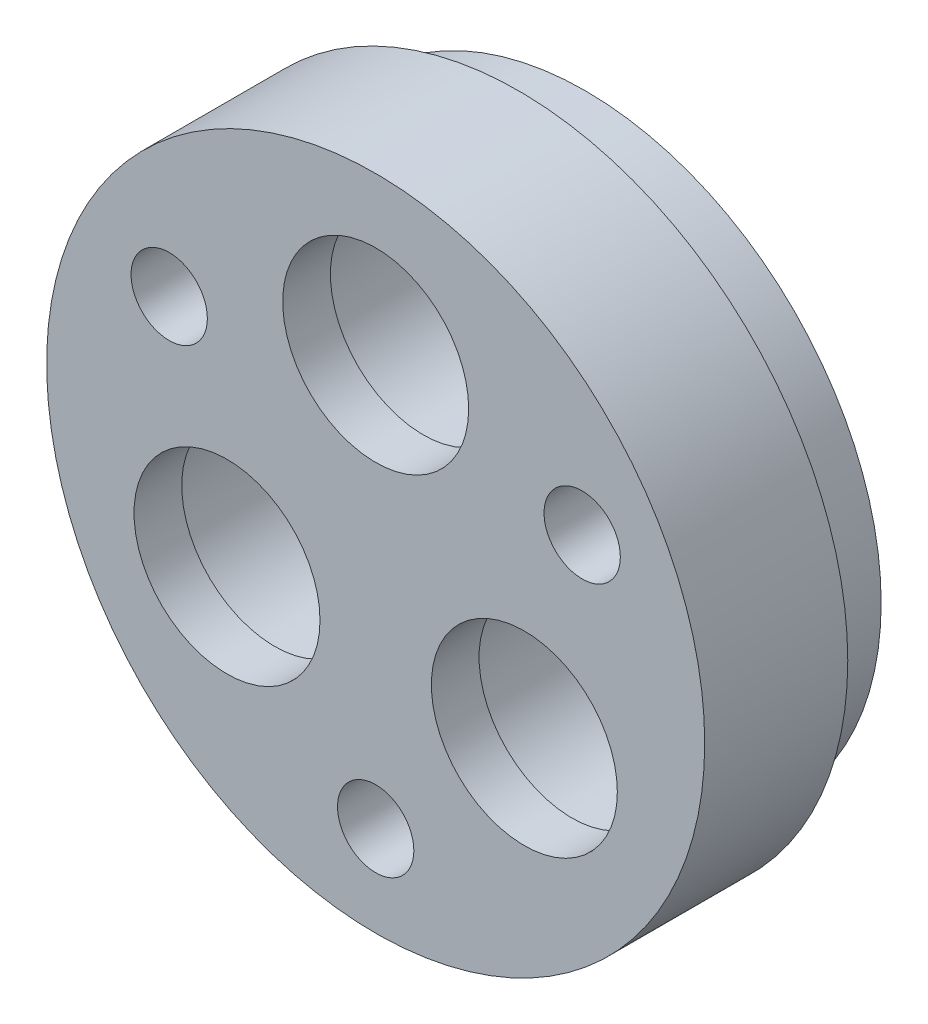
from build123d import *

# Parameters (mm, degrees)
ESQUISSE1_R             = 34.5
BOSS_EXTRU_1_DEPTH      = 15
ESQUISSE2_R             = 10.8
ENL_V_MAT_EXTRU_1_DEPTH = 15
ESQUISSE3_R             = 11
ESQUISSE3_R_2           = 9.75
BOSS_EXTRU_2_DEPTH      = 5
ESQUISSE4_R             = 4
ENL_V_MAT_EXTRU_2_DEPTH = 52.044098582
ESQUISSE6_R             = 31
ESQUISSE6_R_2           = 4
ESQUISSE6_R_3           = 10.8
BOSS_EXTRU_5_DEPTH      = 7


with BuildPart() as part:
    # Esquisse1 → Boss.-Extru.1 (new body)
    with BuildSketch(Plane.XY):
        Circle(ESQUISSE1_R)
    extrude(amount=BOSS_EXTRU_1_DEPTH)

    # Esquisse2 → Enlèv. mat.-Extru.1 (cut)
    with BuildSketch(Plane.XY.offset(15)):
        with Locations((0, 18)):
            Circle(ESQUISSE2_R)
        with Locations((15.588457268, -9)):
            Circle(ESQUISSE2_R)
        with Locations((-15.588457268, -9)):
            Circle(ESQUISSE2_R)
    extrude(amount=-ENL_V_MAT_EXTRU_1_DEPTH, mode=Mode.SUBTRACT)

    # Esquisse3 → Boss.-Extru.2 (add)
    # profile 1 of 3: a face of its own
    with BuildSketch(Plane.XY.offset(15)):
        with Locations((0, 18)):
            Circle(ESQUISSE3_R)
        with Locations((0, 18)):
            Circle(ESQUISSE3_R_2, mode=Mode.SUBTRACT)
    # profile 2 of 3: a face of its own
    with BuildSketch(Plane.XY.offset(15)):
        with Locations((15.588457268, -9)):
            Circle(ESQUISSE3_R)
        with Locations((15.588457268, -9)):
            Circle(ESQUISSE3_R_2, mode=Mode.SUBTRACT)
    # profile 3 of 3: a face of its own
    with BuildSketch(Plane.XY.offset(15)):
        with Locations((-15.588457268, -9)):
            Circle(ESQUISSE3_R)
        with Locations((-15.588457268, -9)):
            Circle(ESQUISSE3_R_2, mode=Mode.SUBTRACT)
    extrude(amount=-BOSS_EXTRU_2_DEPTH)

    # Esquisse4 → Enlèv. mat.-Extru.2 (cut, through all)
    with BuildSketch(Plane.XY.offset(15)):
        with Locations((21.650635095, 12.5)):
            Circle(ESQUISSE4_R)
        with Locations((-21.650635095, 12.5)):
            Circle(ESQUISSE4_R)
        with Locations((0, -25)):
            Circle(ESQUISSE4_R)
    extrude(amount=-ENL_V_MAT_EXTRU_2_DEPTH, mode=Mode.SUBTRACT)

    # Esquisse6 → Boss.-Extru.5 (add)
    with BuildSketch(Plane(origin=(0, 0, 0), x_dir=(-1, 0, 0), z_dir=(0, 0, -1))):
        Circle(ESQUISSE6_R)
        with Locations(Location((0, -25, 0), (0, 0, 180))):
            Circle(ESQUISSE6_R_2, mode=Mode.SUBTRACT)
        with Locations(Location((-15.588457268, -9, 0), (0, 0, 180))):
            Circle(ESQUISSE6_R_3, mode=Mode.SUBTRACT)
        with Locations(Location((0, 18, 0), (0, 0, 180))):
            Circle(ESQUISSE6_R_3, mode=Mode.SUBTRACT)
        with Locations(Location((15.588457268, -9, 0), (0, 0, 180))):
            Circle(ESQUISSE6_R_3, mode=Mode.SUBTRACT)
        with Locations(Location((21.650635095, 12.5, 0), (0, 0, 180))):
            Circle(ESQUISSE6_R_2, mode=Mode.SUBTRACT)
        with Locations(Location((-21.650635095, 12.5, 0), (0, 0, 180))):
            Circle(ESQUISSE6_R_2, mode=Mode.SUBTRACT)
    extrude(amount=BOSS_EXTRU_5_DEPTH)


solid = part.part
